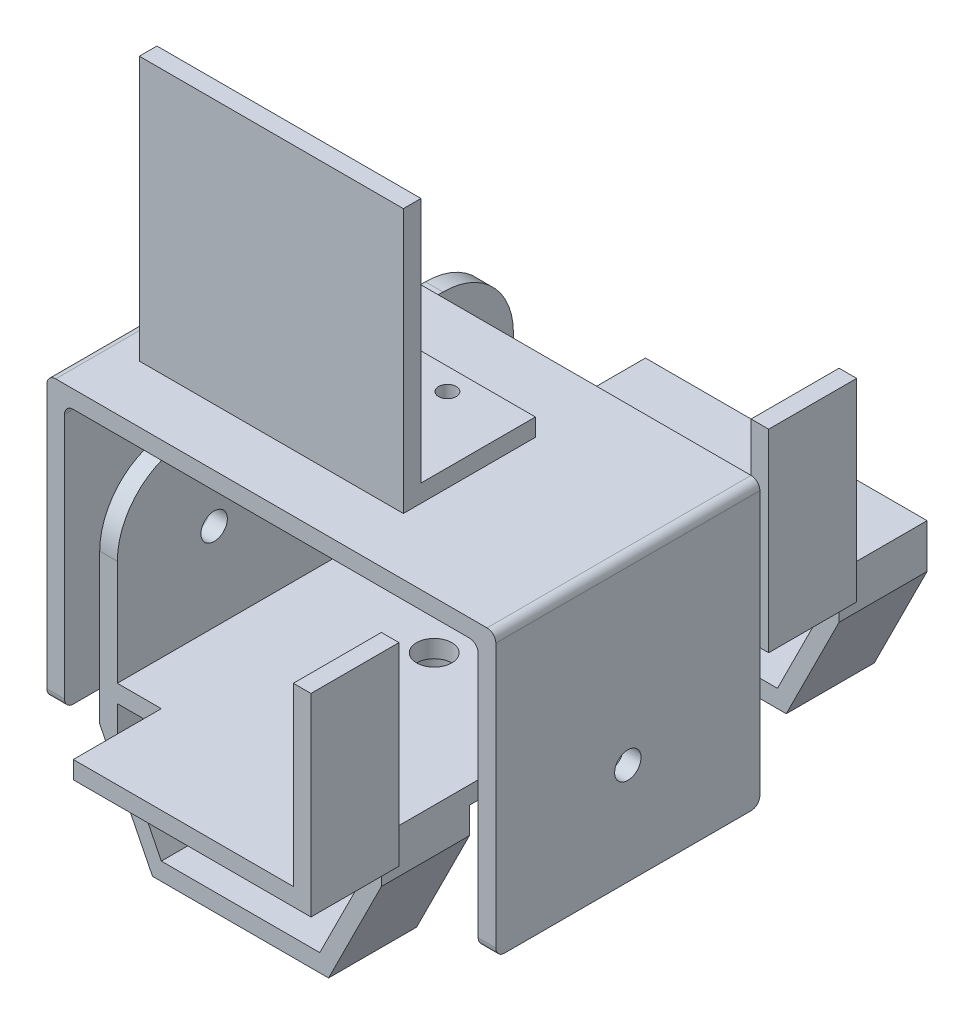
from build123d import *

# Parameters (mm, degrees)
BOSS_EXTRUDE1_DEPTH  = 21
BOSS_EXTRUDE16_START = -21
BOSS_EXTRUDE16_DEPTH = 20
CUT_EXTRUDE4_REACH   = 56.599
SKETCH23_W           = 17
SKETCH23_H           = 20
FILLET1_R            = 8
BOSS_EXTRUDE5_DEPTH  = 10
BOSS_EXTRUDE14_START = -10
BOSS_EXTRUDE14_DEPTH = 10
BOSS_EXTRUDE15_START = -62
BOSS_EXTRUDE15_DEPTH = 10
CUT_EXTRUDE1_REACH   = 50.683
SKETCH5_R            = 2
BOSS_EXTRUDE2_START  = 10
BOSS_EXTRUDE2_DEPTH  = 15
BOSS_EXTRUDE17_DEPTH = 5
SKETCH7_R            = 1.5
CUT_EXTRUDE2_DEPTH   = 73.174805161
SKETCH8_R            = 7.5
SKETCH8_R_2          = 5
SKETCH8_R_3          = 2.5
BOSS_EXTRUDE3_DEPTH  = 2
SKETCH16_R           = 5
SKETCH16_R_2         = 2.5
BOSS_EXTRUDE7_DEPTH  = 7
SKETCH17_R           = 10.5
SKETCH17_R_2         = 2.5
BOSS_EXTRUDE8_DEPTH  = 2
SKETCH18_R           = 5
SKETCH18_R_2         = 2.5
BOSS_EXTRUDE9_DEPTH  = 7
BOSS_EXTRUDE6_DEPTH  = 15
CUT_EXTRUDE3_START   = -4
SKETCH19_R           = 1
CUT_EXTRUDE3_DEPTH   = 4
FILLET2_R            = 1


with BuildPart() as part:
    # Sketch4 → Boss-Extrude1 (new, symmetric)
    with BuildSketch(Plane.XY):
        Polygon((-17, 20), (-17, -2), (15, -2), (15, 0), (-15, 0), (-15, 20), align=None)
    extrude(amount=BOSS_EXTRUDE1_DEPTH, both=True)

    # Sketch4<2> → Boss-Extrude16 (add)
    with BuildSketch(Plane.XY.offset(BOSS_EXTRUDE16_START)):
        Polygon((-17, 20), (-17, -2), (15, -2), (15, 0), (-15, 0), (-15, 20), align=None)
    extrude(amount=-BOSS_EXTRUDE16_DEPTH)

    # Sketch23 → Cut-Extrude4 (cut, up to next)
    with BuildSketch(Plane(origin=(-15, 0, 0), x_dir=(0, 0, -1), z_dir=(1, 0, 0)), mode=Mode.PRIVATE) as cut_extrude4_sk1:
        with Locations((32.5, 10)):
            Rectangle(SKETCH23_W, SKETCH23_H)
    cut_extrude4_tool1 = extrude(cut_extrude4_sk1.sketch, amount=-CUT_EXTRUDE4_REACH, mode=Mode.PRIVATE) & part.part
    add(cut_extrude4_tool1.solids().sort_by_distance((-15, 10, -32.5))[0], mode=Mode.SUBTRACT)

    # Fillet1
    fillet1_edges = [part.edges().sort_by_distance(p)[0] for p in [
        (-16, 20, -24),
        (-16, 20, 21),
    ]]
    fillet(fillet1_edges, radius=FILLET1_R)

    # Sketch11 → Boss-Extrude5 (add)
    with BuildSketch(Plane.XY.offset(21)):
        Polygon((-10, 0), (-10, -2), (17, -2), (17, 20), (15, 20), (15, 0), align=None)
    boss_extrude5 = extrude(amount=BOSS_EXTRUDE5_DEPTH)

    # Mirror1: Boss-Extrude5 across plane
    add(boss_extrude5.mirror(Plane.XY))

    # Sketch21 → Boss-Extrude14 (add)
    with BuildSketch(Plane.XY.offset(31).offset(BOSS_EXTRUDE14_START)):
        Polygon((15, -2), (15, -5), (9, -17), (-11, -17), (-17, -5), (-17, -2), (-15, -2), (-15, -5), (-10, -15), (8, -15), (13, -5), (13, -2), align=None)
    extrude(amount=-BOSS_EXTRUDE14_DEPTH)

    # Sketch21<3> → Boss-Extrude15 (add)
    with BuildSketch(Plane.XY.offset(31).offset(BOSS_EXTRUDE15_START)):
        Polygon((15, -2), (15, -5), (9, -17), (-11, -17), (-17, -5), (-17, -2), (-15, -2), (-15, -5), (-10, -15), (8, -15), (13, -5), (13, -2), align=None)
    extrude(amount=-BOSS_EXTRUDE15_DEPTH)

    # Sketch5 → Cut-Extrude1 (cut, up to next)
    with BuildSketch(Plane(origin=(0, 0, 0), x_dir=(1, 0, 0), z_dir=(0, 1, 0)), mode=Mode.PRIVATE) as cut_extrude1_sk1:
        with Locations(Location((0, 0, 0), (0, 0, 270))):
            Circle(SKETCH5_R)
    cut_extrude1_tool1 = extrude(cut_extrude1_sk1.sketch, amount=-CUT_EXTRUDE1_REACH, mode=Mode.PRIVATE) & part.part
    add(cut_extrude1_tool1.solids().sort_by_distance((0, 0, 0))[0], mode=Mode.SUBTRACT)


with BuildPart() as body_2:
    # Sketch6 → Boss-Extrude2 (new, symmetric)
    with BuildSketch(Plane.XY.offset(BOSS_EXTRUDE2_START)):
        Polygon((-17, -1.55), (-17, 28.45), (30, 28.45), (30, -1.55), (32, -1.55), (32, 30.45), (-19, 30.45), (-19, -1.55), align=None)
    extrude(amount=BOSS_EXTRUDE2_DEPTH, both=True)

    # Sketch24 → Boss-Extrude17 (add, symmetric)
    with BuildSketch(Plane(origin=(0, 0, 10), x_dir=(-1, 0, 0), z_dir=(0, 0, -1))):
        Polygon((-20, 28.45), (-30, 22.45), (-30, 28.45), align=None)
        Polygon((12, 28.45), (17, 23.45), (17, 28.45), align=None)
    extrude(amount=BOSS_EXTRUDE17_DEPTH, both=True)


with BuildPart() as cut_extrude2_tool:
    # Sketch7 → Cut-Extrude2 (new, through all)
    with BuildSketch(Plane(origin=(32, 0, 0), x_dir=(0, 0, -1), z_dir=(1, 0, 0))):
        with Locations((-10, 9.95)):
            Circle(SKETCH7_R)
    extrude(amount=-CUT_EXTRUDE2_DEPTH)


with BuildPart() as part_1:
    add(part.part)

    # Cut-Extrude2: cut by cut_extrude2_tool
    add(cut_extrude2_tool.part, mode=Mode.SUBTRACT)


with BuildPart() as body_2_1:
    add(body_2.part)

    # Cut-Extrude2: cut by cut_extrude2_tool
    add(cut_extrude2_tool.part, mode=Mode.SUBTRACT)


with BuildPart() as body_3:
    # Sketch8 → Boss-Extrude3 (new body)
    # profile 1 of 2: a face of its own
    with BuildSketch(Plane.XZ.offset(2)):
        with Locations(Location((0, 0, 0), (0, 0, 270))):
            Circle(SKETCH8_R)
        Circle(SKETCH8_R_2, mode=Mode.SUBTRACT)
    # profile 2 of 2: a face of its own
    with BuildSketch(Plane.XZ.offset(2)):
        Circle(SKETCH8_R_2)
        with Locations(Location((0, 0, 0), (0, 0, 270))):
            Circle(SKETCH8_R_3, mode=Mode.SUBTRACT)
    extrude(amount=BOSS_EXTRUDE3_DEPTH)

    # Sketch16 → Boss-Extrude7 (add)
    with BuildSketch(Plane.XZ.offset(4)):
        with Locations(Location((0, 0, 0), (0, 0, 270))):
            Circle(SKETCH16_R)
        with Locations(Location((0, 0, 0), (0, 0, 270))):
            Circle(SKETCH16_R_2, mode=Mode.SUBTRACT)
    extrude(amount=BOSS_EXTRUDE7_DEPTH)


with BuildPart() as body_4:
    # Sketch17 → Boss-Extrude8 (new body)
    with BuildSketch(Plane(origin=(30, 0, 0), x_dir=(0, 0, -1), z_dir=(-1, 0, 0))):
        with Locations(Location((-10, -9.95, 0), (0, 0, 90))):
            Circle(SKETCH17_R)
        with Locations(Location((-10, -9.95, 0), (0, 0, 90))):
            Circle(SKETCH17_R_2, mode=Mode.SUBTRACT)
    extrude(amount=BOSS_EXTRUDE8_DEPTH)

    # Sketch18 → Boss-Extrude9 (add)
    with BuildSketch(Plane.ZY.offset(-28)):
        with Locations(Location((10, 9.95, 0), (0, 0, 270))):
            Circle(SKETCH18_R)
        with Locations(Location((10, 9.95, 0), (0, 0, 270))):
            Circle(SKETCH18_R_2, mode=Mode.SUBTRACT)
    extrude(amount=BOSS_EXTRUDE9_DEPTH)


with BuildPart() as body_5:
    # Sketch14 → Boss-Extrude6 (new, symmetric)
    with BuildSketch(Plane(origin=(0, 0, 0), x_dir=(0, 0, -1), z_dir=(1, 0, 0))):
        Polygon((-3.5, 30.45), (-18.5, 30.45), (-18.5, 60.45), (-16.5, 60.45), (-16.5, 32.45), (-3.5, 32.45), align=None)
    extrude(amount=BOSS_EXTRUDE6_DEPTH, both=True)


with BuildPart() as cut_extrude3_tool:
    # Sketch19 → Cut-Extrude3 (new body)
    with BuildSketch(Plane(origin=(0, 32.45, 0), x_dir=(1, 0, 0), z_dir=(0, 1, 0)).offset(CUT_EXTRUDE3_START)):
        with Locations(Location((-7.5, -6, 0), (0, 0, 180))):
            Circle(SKETCH19_R)
        with Locations(Location((7.5, -6, 0), (0, 0, 180))):
            Circle(SKETCH19_R)
        with Locations(Location((7.5, -14, 0), (0, 0, 180))):
            Circle(SKETCH19_R)
        with Locations(Location((-7.5, -14, 0), (0, 0, 180))):
            Circle(SKETCH19_R)
    extrude(amount=CUT_EXTRUDE3_DEPTH)


with BuildPart() as body_2_2:
    add(body_2_1.part)

    # Cut-Extrude3: cut by cut_extrude3_tool
    add(cut_extrude3_tool.part, mode=Mode.SUBTRACT)

    # Fillet2
    fillet2_edges = [body_2_2.edges().sort_by_distance(p)[0] for p in [
        (-18, -1.55, -5),
        (-19, 30.45, 10),
        (32, 30.45, 10),
        (30, 28.45, 20),
        (-17, 28.45, 20),
        (31, -1.55, 25),
        (-18, -1.55, 25),
        (31, -1.55, -5),
    ]]
    fillet(fillet2_edges, radius=FILLET2_R)


with BuildPart() as body_5_1:
    add(body_5.part)

    # Cut-Extrude3: cut by cut_extrude3_tool
    add(cut_extrude3_tool.part, mode=Mode.SUBTRACT)


solid = Compound([part_1.part, body_3.part, body_4.part, body_2_2.part, body_5_1.part])
